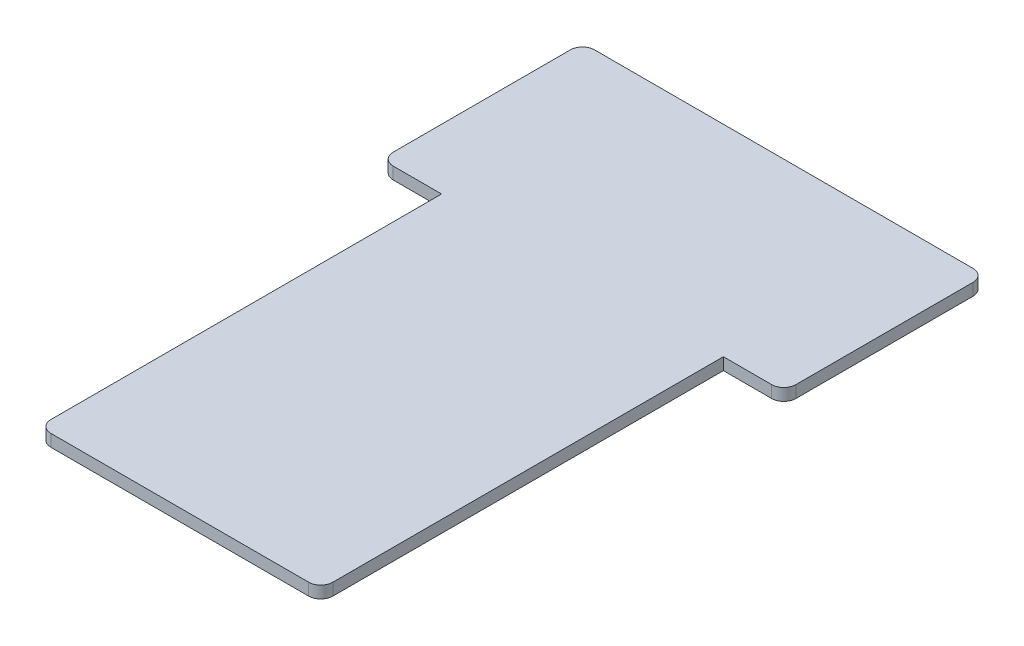
from build123d import *

# Parameters (mm, degrees)
CROQUIS1_W                 = 100
CROQUIS1_H                 = 150
SALIENTE_EXTRUIR2_DEPTH    = 3
CORTAR_EXTRUIR1_DEPTH      = 91.188691087
CORTAR_EXTRUIR1_DEPTH_BACK = 91.188691087
CROQUIS2_W                 = 15
CROQUIS2_H                 = 100
REDONDEO1_R                = 3


with BuildPart() as part:
    # Croquis1 → Saliente-Extruir2 (new body)
    with BuildSketch(Plane(origin=(0, 0, 0), x_dir=(1, 0, 0), z_dir=(0, 1, 0))):
        Rectangle(CROQUIS1_W, CROQUIS1_H)
    extrude(amount=SALIENTE_EXTRUIR2_DEPTH)

    # Croquis2 → Cortar-Extruir1 (cut, two sides: drawn at the far end of the back side and taken through both)
    with BuildSketch(Plane(origin=(0, 3, 0), x_dir=(1, 0, 0), z_dir=(0, 1, 0)).offset(-CORTAR_EXTRUIR1_DEPTH_BACK)):
        with Locations((-42.5, -25)):
            Rectangle(CROQUIS2_W, CROQUIS2_H)
        with Locations((42.5, -25)):
            Rectangle(CROQUIS2_W, CROQUIS2_H)
    extrude(amount=CORTAR_EXTRUIR1_DEPTH + CORTAR_EXTRUIR1_DEPTH_BACK, mode=Mode.SUBTRACT)

    # Redondeo1
    redondeo1_edges = [part.edges().sort_by_distance(p)[0] for p in [
        (-50, 1.5, -25),
        (-35, 1.5, 75),
        (50, 1.5, -25),
        (35, 1.5, 75),
        (-50, 1.5, -75),
        (50, 1.5, -75),
    ]]
    fillet(redondeo1_edges, radius=REDONDEO1_R)


solid = part.part
